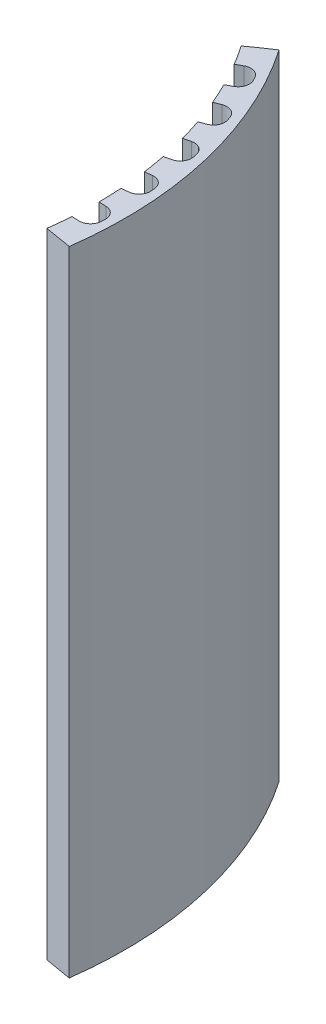
from build123d import *

# Parameters (mm, degrees)
RESSALTO_EXTRUS_O1_DEPTH = 22.5
CORTE_EXTRUS_O1_DEPTH    = 28.741906497


with BuildPart() as part:
    # Esboço1 → Ressalto-extrusão1 (new body)
    with BuildSketch(Plane(origin=(0, 0, 0), x_dir=(1, 0, 0), z_dir=(0, 1, 0))):
        with BuildLine():
            Line((10.760467264, 7.350777988), (10.969182874, 7.504560719))
            ThreePointArc((10.969182874, 7.504560719), (11.122613734, 7.740848698), (11.082224189, 8.019670724))
            Line((11.082224189, 8.019670724), (11.341808671, 8.207519484))
            ThreePointArc((11.341808671, 8.207519484), (13.61934662, 3.242436992), (13.823462506, -2.216277139))
            Line((13.823462506, -2.216277139), (13.507778422, -2.165664391))
            ThreePointArc((13.507778422, -2.165664391), (13.420279696, -1.89483606), (13.174835153, -1.750749321))
            Line((13.174835153, -1.750749321), (12.919194973, -1.707628189))
            ThreePointArc((12.919194973, -1.707628189), (12.966114499, -1.304403152), (13.000451936, -0.899912346))
            Line((13.000451936, -0.899912346), (13.259558649, -0.908575229))
            ThreePointArc((13.259558649, -0.908575229), (13.545442602, -0.801602223), (13.67263107, -0.524120778))
            ThreePointArc((13.67263107, -0.524120778), (13.675032192, -0.457206207), (13.677105833, -0.390280687))
            ThreePointArc((13.677105833, -0.390280687), (13.568735109, -0.104923638), (13.290634577, 0.020905426))
            Line((13.290634577, 0.020905426), (13.031527865, 0.029568308))
            ThreePointArc((13.031527865, 0.029568308), (13.024284113, 0.435449325), (13.004401826, 0.840907789))
            Line((13.004401826, 0.840907789), (13.262351305, 0.866857746))
            ThreePointArc((13.262351305, 0.866857746), (13.53142635, 1.010980886), (13.62049532, 1.302939063))
            ThreePointArc((13.62049532, 1.302939063), (13.613956179, 1.369576627), (13.607091018, 1.436181392))
            ThreePointArc((13.607091018, 1.436181392), (13.461652861, 1.704547935), (13.169262312, 1.792187114))
            Line((13.169262312, 1.792187114), (12.911312833, 1.766237157))
            ThreePointArc((12.911312833, 1.766237157), (12.850035069, 2.167531198), (12.776287858, 2.566721906))
            Line((12.776287858, 2.566721906), (13.028476989, 2.626821624))
            ThreePointArc((13.028476989, 2.626821624), (13.275941474, 2.805523017), (13.325301509, 3.106747926))
            ThreePointArc((13.325301509, 3.106747926), (13.309938795, 3.171919333), (13.294257343, 3.23701478))
            ThreePointArc((13.294257343, 3.23701478), (13.114347099, 3.48360181), (12.812884249, 3.531487182))
            Line((12.812884249, 3.531487182), (12.560695118, 3.471387463))
            ThreePointArc((12.560695118, 3.471387463), (12.446476845, 3.860933427), (12.32018073, 4.246732809))
            Line((12.32018073, 4.246732809), (12.562109192, 4.339909808))
            ThreePointArc((12.562109192, 4.339909808), (12.783547108, 4.550000523), (12.792317376, 4.855116798))
            ThreePointArc((12.792317376, 4.855116798), (12.768405238, 4.917659063), (12.744187329, 4.980083563))
            ThreePointArc((12.744187329, 4.980083563), (12.533015503, 5.200490728), (12.227859963, 5.207767777))
            Line((12.227859963, 5.207767777), (11.985931502, 5.114590777))
            ThreePointArc((11.985931502, 5.114590777), (11.820810947, 5.485437206), (11.644219685, 5.850960664))
            Line((11.644219685, 5.850960664), (11.871570259, 5.975552199))
            ThreePointArc((11.871570259, 5.975552199), (12.06303004, 6.213283162), (12.031054037, 6.516845996))
            ThreePointArc((12.031054037, 6.516845996), (11.999019187, 6.575643051), (11.966696991, 6.634282636))
            ThreePointArc((11.966696991, 6.634282636), (11.728031948, 6.824576766), (11.424629227, 6.791115632))
            Line((11.424629227, 6.791115632), (11.197278653, 6.666524097))
            ThreePointArc((11.197278653, 6.666524097), (10.984202397, 7.012053229), (10.760467264, 7.350777988))
        make_face()
    extrude(amount=RESSALTO_EXTRUS_O1_DEPTH)

    # Esboço2 → Corte-extrusão1 (cut, through all)
    with BuildSketch(Plane(origin=(0, 22.5, 0), x_dir=(1, 0, 0), z_dir=(0, 1, 0))):
        with BuildLine():
            Line((13.174835153, -1.750749321), (13.874709853, -1.868803493))
            ThreePointArc((13.874709853, -1.868803493), (13.850175901, -2.042701034), (13.823462506, -2.216277139))
            Line((13.823462506, -2.216277139), (13.507778422, -2.165664391))
            ThreePointArc((13.507778422, -2.165664391), (13.420279696, -1.89483606), (13.174835153, -1.750749321))
        make_face()
        with BuildLine():
            Line((10.969182874, 7.504560719), (11.554630395, 7.905094334))
            ThreePointArc((11.554630395, 7.905094334), (11.449218127, 8.057009637), (11.341808671, 8.207519484))
            Line((11.341808671, 8.207519484), (11.082224189, 8.019670724))
            ThreePointArc((11.082224189, 8.019670724), (11.122613734, 7.740848698), (10.969182874, 7.504560719))
        make_face()
    extrude(amount=-CORTE_EXTRUS_O1_DEPTH, mode=Mode.SUBTRACT)


solid = part.part
